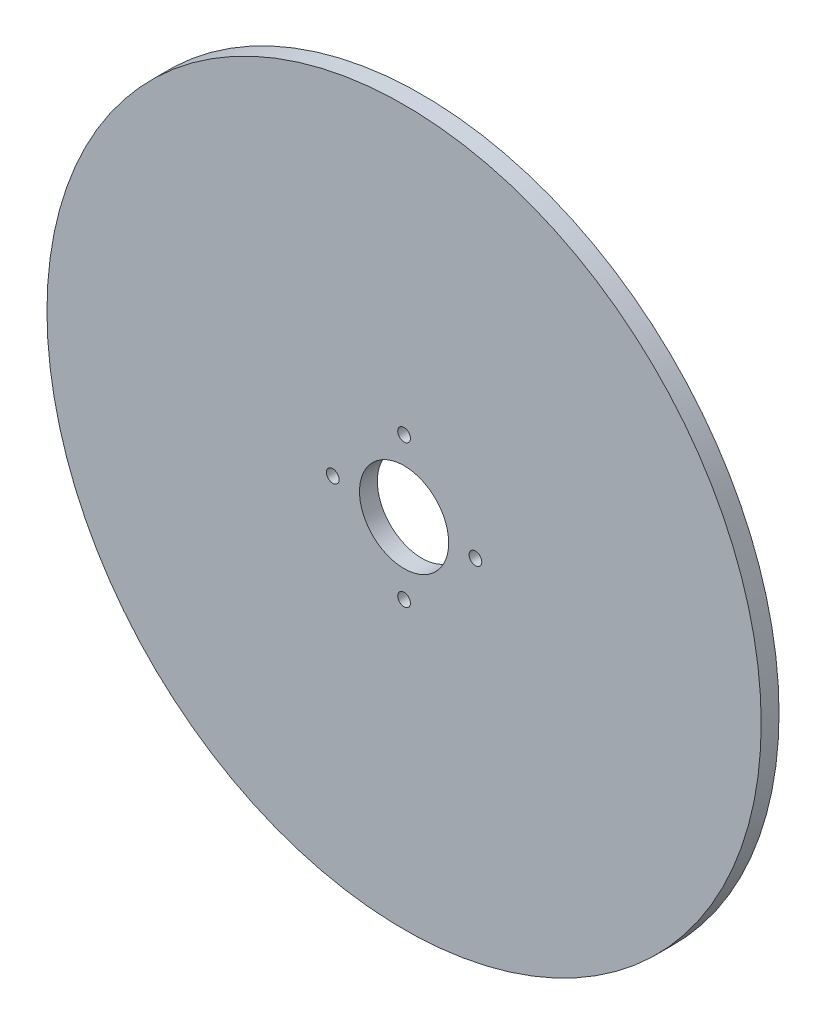
from build123d import *

# Parameters (mm, degrees)
SKETCH1_R                     = 63.5762
SKETCH1_R_2                   = 7.9375
BOSS_EXTRUDE1_DEPTH           = 3.175
TAP_DRILL_FOR_4_40_TAP1_D     = 2.2606
TAP_DRILL_FOR_4_40_TAP1_DEPTH = 4
TAP_DRILL_FOR_4_40_TAP1_TIP   = 0.679152758


with BuildPart() as part:
    # Sketch1 → Boss-Extrude1 (new body)
    with BuildSketch(Plane.XY):
        Circle(SKETCH1_R)
        Circle(SKETCH1_R_2, mode=Mode.SUBTRACT)
    extrude(amount=BOSS_EXTRUDE1_DEPTH)

    # Tap Drill for #4-40 Tap1
    with Locations(Plane.XY.offset(3.175)):
        with Locations((0, 12.7), (0, -12.7), (12.7, 0), (-12.7, 0)):
            Hole(TAP_DRILL_FOR_4_40_TAP1_D / 2, depth=TAP_DRILL_FOR_4_40_TAP1_DEPTH)
            with Locations((0, 0, -(TAP_DRILL_FOR_4_40_TAP1_DEPTH + TAP_DRILL_FOR_4_40_TAP1_TIP / 2))):  # 118° drill point
                Cone(0, TAP_DRILL_FOR_4_40_TAP1_D / 2, TAP_DRILL_FOR_4_40_TAP1_TIP, mode=Mode.SUBTRACT)


solid = part.part
